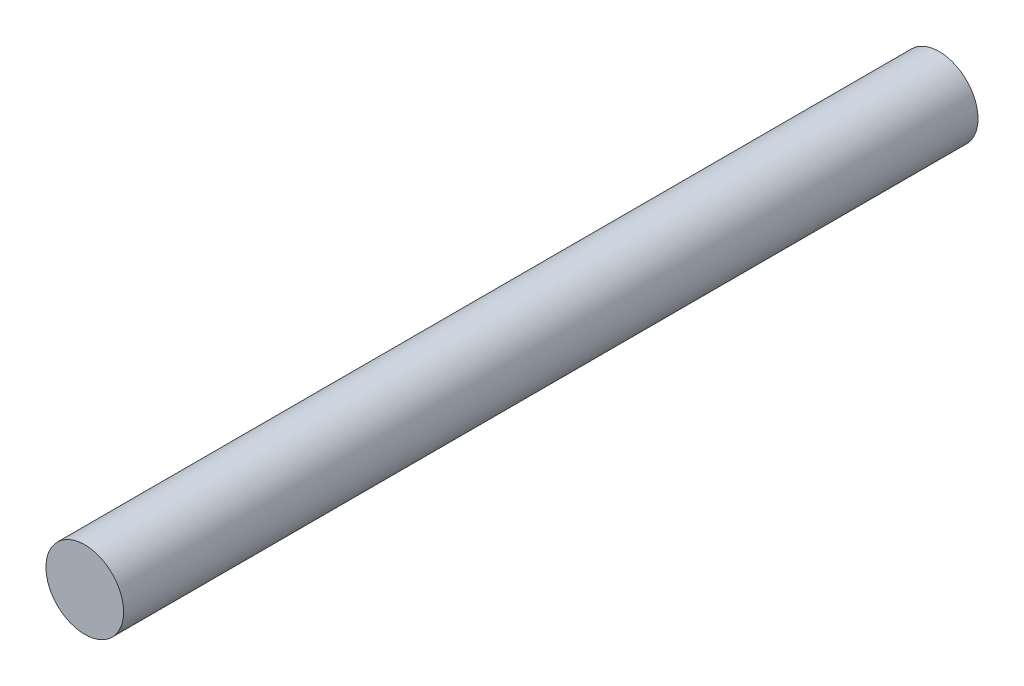
from build123d import *

# Parameters (mm, degrees)
BOSS_EXTRUDE1_DEPTH      = 11
BOSS_EXTRUDE1_DEPTH_BACK = 11
SKETCH1_R                = 1


with BuildPart() as part:
    # Sketch1 → Boss-Extrude1 (new, two sides: drawn at the far end of the back side and taken through both)
    with BuildSketch(Plane.XY.offset(-BOSS_EXTRUDE1_DEPTH_BACK)):
        Circle(SKETCH1_R)
    extrude(amount=BOSS_EXTRUDE1_DEPTH + BOSS_EXTRUDE1_DEPTH_BACK)


solid = part.part
